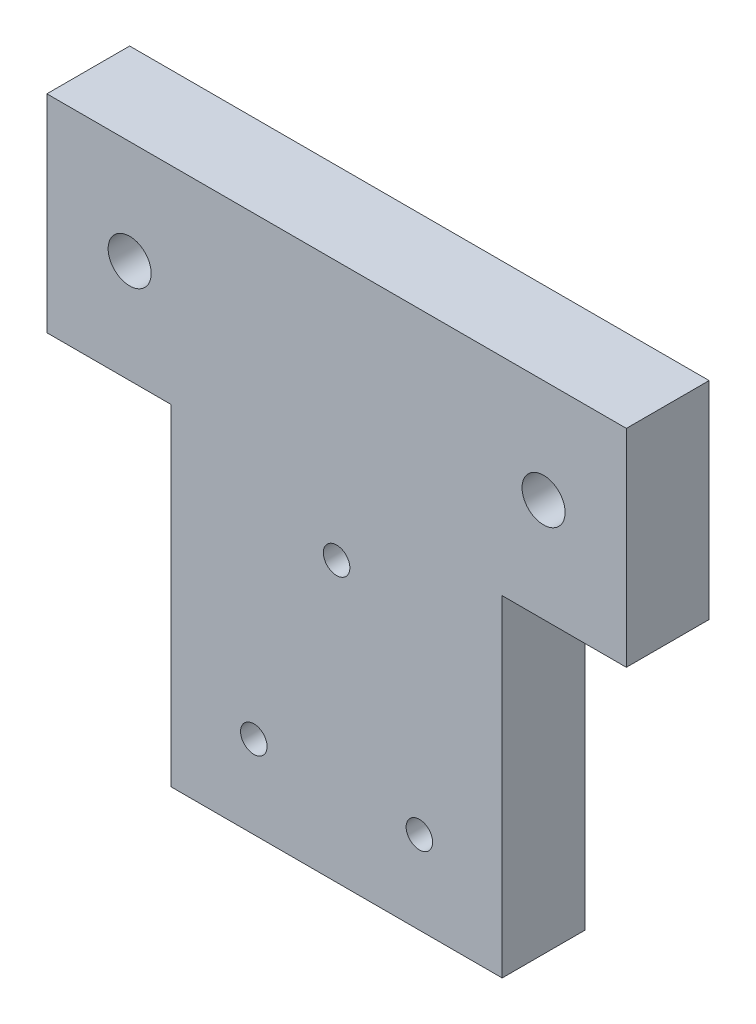
from build123d import *

# Parameters (mm, degrees)
BOSS_EXTRUDE1_DEPTH = 10
SKETCH6_R           = 1.6
CUT_EXTRUDE1_DEPTH  = 10
SKETCH7_R           = 1.6
CUT_EXTRUDE2_DEPTH  = 10
SKETCH9_R           = 2.6
CUT_EXTRUDE4_DEPTH  = 10


with BuildPart() as part:
    # Sketch1 → Boss-Extrude1 (new body)
    with BuildSketch(Plane.XY):
        Polygon((-35, 0), (35, 0), (35, -25), (20, -25), (20, -65), (-20, -65), (-20, -25), (-35, -25), align=None)
    extrude(amount=BOSS_EXTRUDE1_DEPTH)

    # Sketch6 → Cut-Extrude1 (cut)
    with BuildSketch(Plane(origin=(0, 0, 0), x_dir=(-1, 0, 0), z_dir=(0, 0, -1))):
        with Locations((10, -55)):
            Circle(SKETCH6_R)
        with Locations((-10, -55)):
            Circle(SKETCH6_R)
    extrude(amount=-CUT_EXTRUDE1_DEPTH, mode=Mode.SUBTRACT)

    # Sketch7 → Cut-Extrude2 (cut)
    with BuildSketch(Plane(origin=(0, 0, 0), x_dir=(-1, 0, 0), z_dir=(0, 0, -1))):
        with Locations((0, -31.3)):
            Circle(SKETCH7_R)
    extrude(amount=-CUT_EXTRUDE2_DEPTH, mode=Mode.SUBTRACT)

    # Sketch9 → Cut-Extrude4 (cut)
    with BuildSketch(Plane.XY.offset(10)):
        with Locations((-25, -12.5)):
            Circle(SKETCH9_R)
        with Locations((25, -12.5)):
            Circle(SKETCH9_R)
    extrude(amount=-CUT_EXTRUDE4_DEPTH, mode=Mode.SUBTRACT)


solid = part.part
